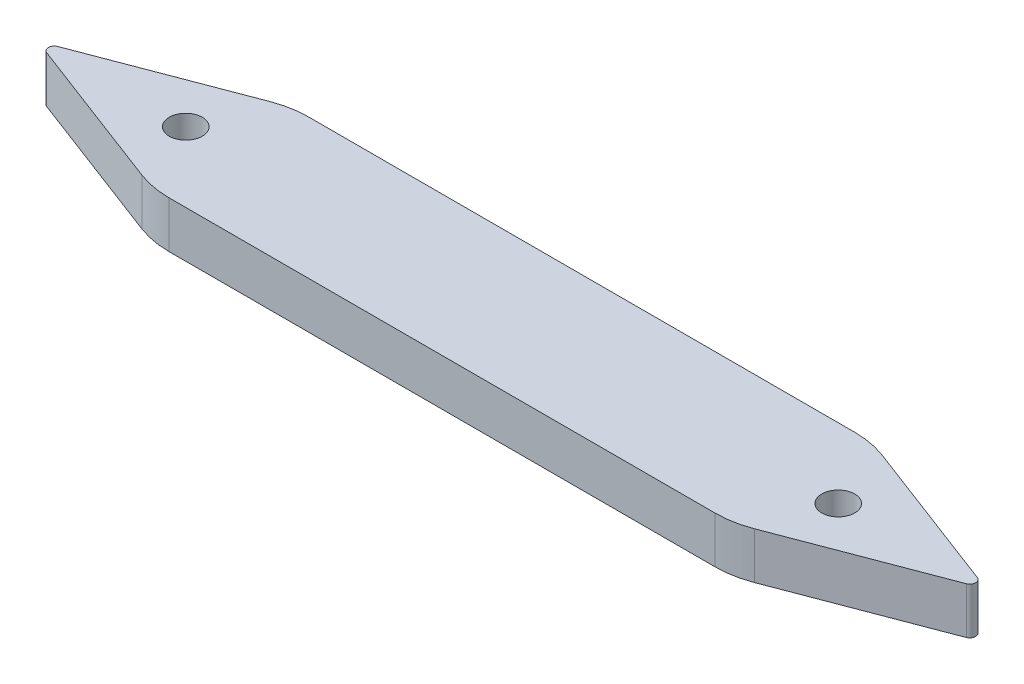
from build123d import *

# Parameters (mm, degrees)
BOSS_EXTRUDE2_DEPTH                               = 22.225
BOSS_EXTRUDE2_DEPTH_BACK                          = 10
SKETCH2_W                                         = 153.14353988
SKETCH2_H                                         = 6.35
CUT_EXTRUDE1_DEPTH                                = 4.7625
SKETCH3_W                                         = 152.758434582
SKETCH3_H                                         = 6.35
CUT_EXTRUDE2_DEPTH                                = 4.7625
FILLET3_R                                         = 12.7
FILLET4_R                                         = 12.7
FILLET5_R                                         = 12.7
FILLET6_R                                         = 12.7
CUT_EXTRUDE3_DEPTH                                = 94.675
CUT_EXTRUDE3_DEPTH_BACK                           = 84.675
SKETCH12_R                                        = 168.402
CSK_FOR_8_FLAT_HEAD_SOCKET_CAP_SCREW2_D           = 4.4958
CSK_FOR_8_FLAT_HEAD_SOCKET_CAP_SCREW2_CSINK_D     = 9.1186
CSK_FOR_8_FLAT_HEAD_SOCKET_CAP_SCREW2_CSINK_ANGLE = 82
SKETCH23_W                                        = 142.352901873
SKETCH23_H                                        = 23.794517811
CUT_EXTRUDE4_DEPTH                                = 27.432
SKETCH24_W                                        = 135.994176645
SKETCH24_H                                        = 28.515775484
CUT_EXTRUDE5_DEPTH                                = 27.432


with BuildPart() as part:
    # Sketch1 → Boss-Extrude2 (new, two sides: drawn at the far end of the back side and taken through both)
    with BuildSketch(Plane(origin=(0, 0, 0), x_dir=(1, 0, 0), z_dir=(0, 1, 0)).offset(-BOSS_EXTRUDE2_DEPTH_BACK)):
        with BuildLine():
            Line((37.204956004, 9.525), (-37.204956004, 9.525))
            ThreePointArc((-37.204956004, 9.525), (-39.498289417, 9.316221792), (-41.716221563, 8.696751473))
            Line((-41.716221563, 8.696751473), (-62.649818949, 0.741984467))
            ThreePointArc((-62.649818949, 0.741984467), (-63.161614851, 0), (-62.649818949, -0.741984467))
            Line((-62.649818949, -0.741984467), (-41.716221563, -8.696751473))
            ThreePointArc((-41.716221563, -8.696751473), (-39.498289417, -9.316221792), (-37.204956004, -9.525))
            Line((-37.204956004, -9.525), (37.204956004, -9.525))
            ThreePointArc((37.204956004, -9.525), (39.498289417, -9.316221792), (41.716221563, -8.696751473))
            Line((41.716221563, -8.696751473), (62.649818949, -0.741984467))
            ThreePointArc((62.649818949, -0.741984467), (63.161614851, 0), (62.649818949, 0.741984467))
            Line((62.649818949, 0.741984467), (41.716221563, 8.696751473))
            ThreePointArc((41.716221563, 8.696751473), (39.498289417, 9.316221792), (37.204956004, 9.525))
        make_face()
    extrude(amount=BOSS_EXTRUDE2_DEPTH + BOSS_EXTRUDE2_DEPTH_BACK)

    # Sketch2 → Cut-Extrude1 (cut)
    with BuildSketch(Plane.XY.offset(9.525)):
        with Locations((7.894658594, 12.7)):
            Rectangle(SKETCH2_W, SKETCH2_H)
    extrude(amount=-CUT_EXTRUDE1_DEPTH, mode=Mode.SUBTRACT)

    # Sketch3 → Cut-Extrude2 (cut)
    with BuildSketch(Plane(origin=(0, 0, -9.525), x_dir=(-1, 0, 0), z_dir=(0, 0, -1))):
        with Locations((8.600684972, 12.7)):
            Rectangle(SKETCH3_W, SKETCH3_H)
    extrude(amount=-CUT_EXTRUDE2_DEPTH, mode=Mode.SUBTRACT)

    # Fillet3
    fillet3_edges = [part.edges().sort_by_distance(p)[0] for p in [
        (52.069514915, 12.7, -4.7625),
    ]]
    fillet(fillet3_edges, radius=FILLET3_R)

    # Fillet4
    fillet4_edges = [part.edges().sort_by_distance(p)[0] for p in [
        (52.069514915, 12.7, 4.7625),
    ]]
    fillet(fillet4_edges, radius=FILLET4_R)

    # Fillet5
    fillet5_edges = [part.edges().sort_by_distance(p)[0] for p in [
        (-52.069514915, 12.7, 4.7625),
    ]]
    fillet(fillet5_edges, radius=FILLET5_R)

    # Fillet6
    fillet6_edges = [part.edges().sort_by_distance(p)[0] for p in [
        (-52.069514915, 12.7, -4.7625),
    ]]
    fillet(fillet6_edges, radius=FILLET6_R)

    # Sketch12 → Cut-Extrude3 (cut, two sides: drawn at the far end of the back side and taken through both)
    with BuildSketch(Plane(origin=(0, 0, 0), x_dir=(0, 0, -1), z_dir=(1, 0, 0)).offset(-CUT_EXTRUDE3_DEPTH_BACK)):
        with Locations((0, -168.402)):
            Circle(SKETCH12_R)
    extrude(amount=CUT_EXTRUDE3_DEPTH + CUT_EXTRUDE3_DEPTH_BACK, mode=Mode.SUBTRACT)

    # CSK for #8 Flat Head Socket Cap Screw2 (through all)
    with Locations(Plane(origin=(0, 22.225, 0), x_dir=(1, 0, 0), z_dir=(0, 1, 0))):
        with Locations((-44.45, 0), (44.45, 0)):
            CounterSinkHole(CSK_FOR_8_FLAT_HEAD_SOCKET_CAP_SCREW2_D / 2, CSK_FOR_8_FLAT_HEAD_SOCKET_CAP_SCREW2_CSINK_D / 2, counter_sink_angle=CSK_FOR_8_FLAT_HEAD_SOCKET_CAP_SCREW2_CSINK_ANGLE)

    # Sketch23 → Cut-Extrude4 (cut)
    with BuildSketch(Plane(origin=(0, 9.525, 0), x_dir=(1, 0, 0), z_dir=(0, 1, 0))):
        with Locations((0.40453065, 0.369494074)):
            Rectangle(SKETCH23_W, SKETCH23_H)
    extrude(amount=CUT_EXTRUDE4_DEPTH, mode=Mode.SUBTRACT)

    # Sketch24 → Cut-Extrude5 (cut)
    with BuildSketch(Plane(origin=(0, 3.175, 0), x_dir=(1, 0, 0), z_dir=(0, 1, 0))):
        with Locations((-1.937475732, -0.84145337)):
            Rectangle(SKETCH24_W, SKETCH24_H)
    extrude(amount=-CUT_EXTRUDE5_DEPTH, mode=Mode.SUBTRACT)


solid = part.part
